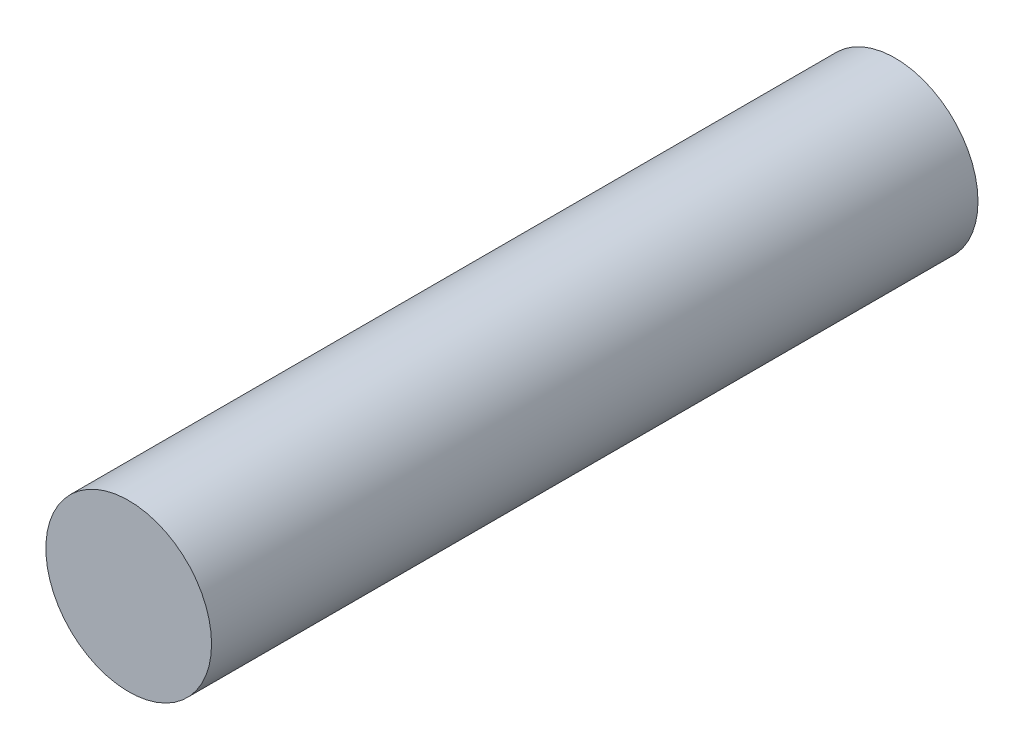
from build123d import *

# Parameters (mm, degrees)
SKETCH1_R           = 4
BOSS_EXTRUDE1_DEPTH = 37


with BuildPart() as part:
    # Sketch1 → Boss-Extrude1 (new body)
    with BuildSketch(Plane.XY):
        Circle(SKETCH1_R)
    extrude(amount=BOSS_EXTRUDE1_DEPTH)


solid = part.part
